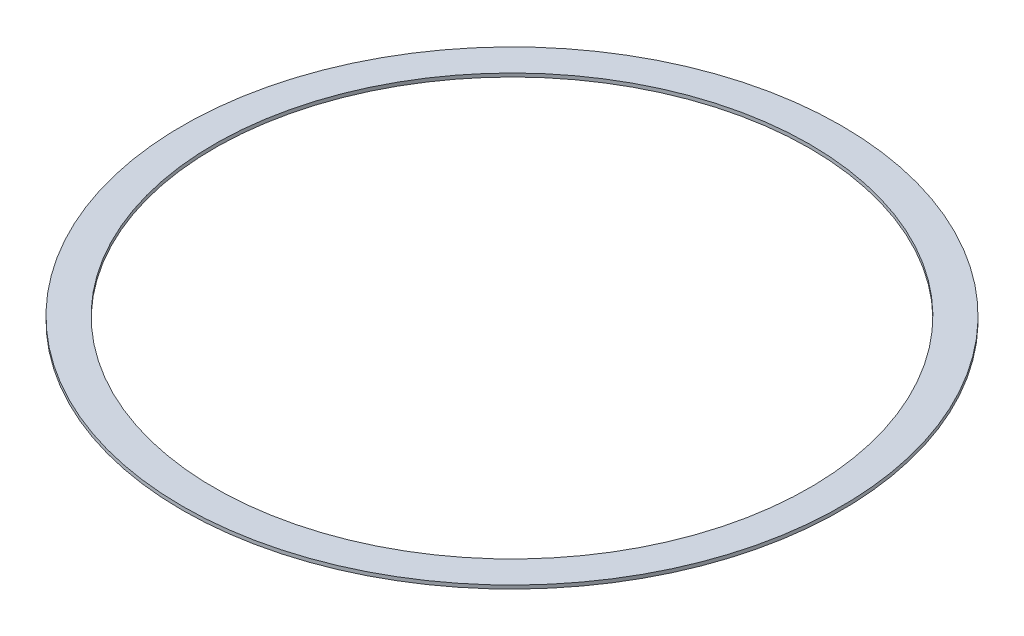
from build123d import *

# Parameters (mm, degrees)
SKETCH1_R           = 72.0725
SKETCH1_R_2         = 65.0875
BOSS_EXTRUDE1_DEPTH = 0.762


with BuildPart() as part:
    # Sketch1 → Boss-Extrude1 (new body)
    with BuildSketch(Plane(origin=(0, 0, 0), x_dir=(1, 0, 0), z_dir=(0, 1, 0))):
        with Locations(Location((0, 0, 0), (0, 0, 90))):
            Circle(SKETCH1_R)
        with Locations(Location((0, 0, 0), (0, 0, 90))):
            Circle(SKETCH1_R_2, mode=Mode.SUBTRACT)
    extrude(amount=BOSS_EXTRUDE1_DEPTH)


solid = part.part
